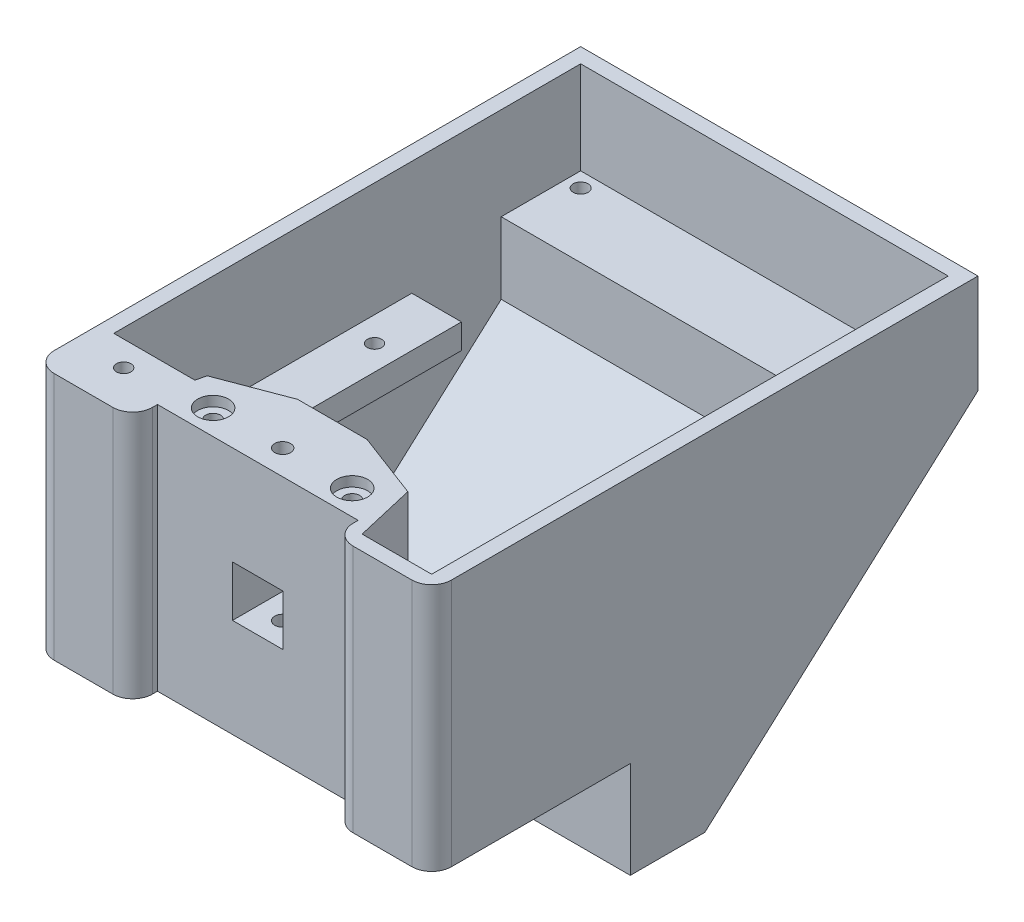
from build123d import *

# Parameters (mm, degrees)
BOSS_EXTRUDE1_DEPTH = 80
SHELL1_T            = -3
SKETCH3_W           = 46
SKETCH3_H           = 47
BOSS_EXTRUDE2_DEPTH = 17
SKETCH4_W           = 10.2
SKETCH4_H           = 10.2
CUT_EXTRUDE1_DEPTH  = 20
SKETCH6_W           = 15
SKETCH6_H           = 12.8
CUT_EXTRUDE2_DEPTH  = 3
SKETCH7_W           = 40.4
SKETCH7_H           = 50
CUT_EXTRUDE3_DEPTH  = 5
FILLET1_R           = 4
CUT_EXTRUDE7_DEPTH  = 47
SKETCH13_R          = 1.5
CUT_EXTRUDE8_DEPTH  = 25
SKETCH14_R          = 3.1
CUT_EXTRUDE9_DEPTH  = 2
SKETCH17_W          = 45
SKETCH17_H          = 5
BOSS_EXTRUDE5_DEPTH = 74
CUT_EXTRUDE10_REACH = 126.093
SKETCH18_W          = 54
SKETCH18_H          = 45
CUT_EXTRUDE11_REACH = 126.093
SKETCH19_R          = 1.45
BOSS_EXTRUDE6_DEPTH = 47
SKETCH22_R          = 1.45
CUT_EXTRUDE12_DEPTH = 135.415364765
BOSS_EXTRUDE7_DEPTH = 74
SKETCH27_R          = 1.5
CUT_EXTRUDE14_DEPTH = 10
CUT_EXTRUDE15_START = -3
CUT_EXTRUDE15_DEPTH = 32
CUT_EXTRUDE16_DEPTH = 30
BOSS_EXTRUDE8_DEPTH = 20
SKETCH31_R          = 1.5
CUT_EXTRUDE17_DEPTH = 123.649786567
CUT_EXTRUDE18_DEPTH = 15
CUT_EXTRUDE19_REACH = 126.093
SKETCH33_W          = 10
SKETCH33_H          = 5
SKETCH34_R          = 1.6
CUT_EXTRUDE20_DEPTH = 135.415364765
CUT_EXTRUDE22_DEPTH = 14


with BuildPart() as part:
    # Sketch2 → Boss-Extrude1 (new body)
    with BuildSketch(Plane(origin=(0, 0, 0), x_dir=(0, 0, -1), z_dir=(1, 0, 0))):
        Polygon((-27.320490368, 20.998248687), (-27.320490368, -29.001751313), (12.679509632, -29.001751313), (12.679509632, -48.511383538), (27.679509632, -48.511383538), (82.679509632, 0.998248687), (82.679509632, 20.998248687), align=None)
    extrude(amount=BOSS_EXTRUDE1_DEPTH)

    # Shell1
    shell1_openings = [part.faces().sort_by_distance(p)[0] for p in [
        (40, 20.998248687, -27.679509632),
    ]]
    offset(amount=SHELL1_T, openings=shell1_openings, kind=Kind.INTERSECTION)

    # Sketch3 → Boss-Extrude2 (add)
    with BuildSketch(Plane(origin=(0, 0, 24.320490368), x_dir=(-1, 0, 0), z_dir=(0, 0, -1))):
        with Locations((-40, -2.501751313)):
            Rectangle(SKETCH3_W, SKETCH3_H)
    extrude(amount=BOSS_EXTRUDE2_DEPTH)

    # Sketch4 → Cut-Extrude1 (cut)
    with BuildSketch(Plane.XY.offset(27.320490368)):
        with Locations((40, -4.001751313)):
            Rectangle(SKETCH4_W, SKETCH4_H)
    extrude(amount=-CUT_EXTRUDE1_DEPTH, mode=Mode.SUBTRACT)

    # Sketch6 → Cut-Extrude2 (cut)
    with BuildSketch(Plane.XZ.offset(29.001751313)):
        with Locations((40, 0.920490368)):
            Rectangle(SKETCH6_W, SKETCH6_H)
    extrude(amount=-CUT_EXTRUDE2_DEPTH, mode=Mode.SUBTRACT)

    # Sketch7 → Cut-Extrude3 (cut)
    with BuildSketch(Plane.XY.offset(27.320490368)):
        with Locations((40, -4.001751313)):
            Rectangle(SKETCH7_W, SKETCH7_H)
    extrude(amount=-CUT_EXTRUDE3_DEPTH, mode=Mode.SUBTRACT)

    # Fillet1
    fillet1_edges = [part.edges().sort_by_distance(p)[0] for p in [
        (80, -4.001751313, 27.320490368),
        (19.8, -4.001751313, 27.320490368),
        (0, -4.001751313, 27.320490368),
        (60.2, -4.001751313, 27.320490368),
    ]]
    fillet(fillet1_edges, radius=FILLET1_R)

    # Sketch12 → Cut-Extrude7 (cut)
    with BuildSketch(Plane(origin=(0, 20.998248687, 0), x_dir=(1, 0, 0), z_dir=(0, 1, 0))):
        Polygon((33, -7.320490368), (19.8, -12.320490368), (17, -24.320490368), (17, -7.320490368), align=None)
        Polygon((47, -7.320490368), (63, -7.320490368), (63, -24.320490368), (60.2, -12.320490368), align=None)
    extrude(amount=-CUT_EXTRUDE7_DEPTH, mode=Mode.SUBTRACT)

    # Sketch13 → Cut-Extrude8 (cut)
    with BuildSketch(Plane(origin=(0, 20.998248687, 0), x_dir=(1, 0, 0), z_dir=(0, 1, 0))):
        with Locations(Location((26, -17.320490368, 0), (0, 0, 270))):
            Circle(SKETCH13_R)
        with Locations(Location((54, -17.320490368, 0), (0, 0, 270))):
            Circle(SKETCH13_R)
    extrude(amount=-CUT_EXTRUDE8_DEPTH, mode=Mode.SUBTRACT)

    # Sketch14 → Cut-Extrude9 (cut)
    with BuildSketch(Plane(origin=(0, 20.998248687, 0), x_dir=(1, 0, 0), z_dir=(0, 1, 0))):
        with Locations(Location((26, -17.320490368, 0), (0, 0, 270))):
            Circle(SKETCH14_R)
        with Locations(Location((54, -17.320490368, 0), (0, 0, 270))):
            Circle(SKETCH14_R)
    extrude(amount=-CUT_EXTRUDE9_DEPTH, mode=Mode.SUBTRACT)

    # Sketch17 → Boss-Extrude5 (add)
    with BuildSketch(Plane.ZY.offset(-77)):
        with Locations((-23.179509632, -4.501751313)):
            Rectangle(SKETCH17_W, SKETCH17_H)
    extrude(amount=BOSS_EXTRUDE5_DEPTH)

    # Sketch18 → Cut-Extrude10 (cut, up to next)
    with BuildSketch(Plane(origin=(0, -2.001751313, 0), x_dir=(1, 0, 0), z_dir=(0, 1, 0)), mode=Mode.PRIVATE) as cut_extrude10_sk1:
        with Locations((40, 23.179509632)):
            Rectangle(SKETCH18_W, SKETCH18_H)
    cut_extrude10_tool1 = extrude(cut_extrude10_sk1.sketch, amount=-CUT_EXTRUDE10_REACH, mode=Mode.PRIVATE) & part.part
    add(cut_extrude10_tool1.solids().sort_by_distance((40, -2.001751, -23.17951))[0], mode=Mode.SUBTRACT)

    # Sketch19 → Cut-Extrude11 (cut, up to next)
    with BuildSketch(Plane(origin=(0, -2.001751313, 0), x_dir=(1, 0, 0), z_dir=(0, 1, 0)), mode=Mode.PRIVATE) as cut_extrude11_sk1:
        with Locations(Location((72, 37.179509632, 0), (0, 0, 270))):
            Circle(SKETCH19_R)
    cut_extrude11_tool1 = extrude(cut_extrude11_sk1.sketch, amount=-CUT_EXTRUDE11_REACH, mode=Mode.PRIVATE) & part.part
    # Sketch19 → Cut-Extrude11 (cut, up to next)
    with BuildSketch(Plane(origin=(0, -2.001751313, 0), x_dir=(1, 0, 0), z_dir=(0, 1, 0)), mode=Mode.PRIVATE) as cut_extrude11_sk2:
        with Locations(Location((72, 6.179509632, 0), (0, 0, 270))):
            Circle(SKETCH19_R)
    cut_extrude11_tool2 = extrude(cut_extrude11_sk2.sketch, amount=-CUT_EXTRUDE11_REACH, mode=Mode.PRIVATE) & part.part
    # Sketch19 → Cut-Extrude11 (cut, up to next)
    with BuildSketch(Plane(origin=(0, -2.001751313, 0), x_dir=(1, 0, 0), z_dir=(0, 1, 0)), mode=Mode.PRIVATE) as cut_extrude11_sk3:
        with Locations(Location((8, 33.179509632, 0), (0, 0, 270))):
            Circle(SKETCH19_R)
    cut_extrude11_tool3 = extrude(cut_extrude11_sk3.sketch, amount=-CUT_EXTRUDE11_REACH, mode=Mode.PRIVATE) & part.part
    # Sketch19 → Cut-Extrude11 (cut, up to next)
    with BuildSketch(Plane(origin=(0, -2.001751313, 0), x_dir=(1, 0, 0), z_dir=(0, 1, 0)), mode=Mode.PRIVATE) as cut_extrude11_sk4:
        with Locations(Location((8, 6.179509632, 0), (0, 0, 270))):
            Circle(SKETCH19_R)
    cut_extrude11_tool4 = extrude(cut_extrude11_sk4.sketch, amount=-CUT_EXTRUDE11_REACH, mode=Mode.PRIVATE) & part.part
    add(cut_extrude11_tool1.solids().sort_by_distance((72, -2.001751, -37.17951))[0], mode=Mode.SUBTRACT)
    add(cut_extrude11_tool2.solids().sort_by_distance((72, -2.001751, -6.17951))[0], mode=Mode.SUBTRACT)
    add(cut_extrude11_tool3.solids().sort_by_distance((8, -2.001751, -33.17951))[0], mode=Mode.SUBTRACT)
    add(cut_extrude11_tool4.solids().sort_by_distance((8, -2.001751, -6.17951))[0], mode=Mode.SUBTRACT)

    # Sketch21 → Boss-Extrude6 (add)
    with BuildSketch(Plane(origin=(0, -26.001751313, 0), x_dir=(1, 0, 0), z_dir=(0, 1, 0))):
        Polygon((3, -24.320490368), (3, -14.320490368), (19.333333333, -14.320490368), (17, -24.320490368), align=None)
    extrude(amount=BOSS_EXTRUDE6_DEPTH)

    # Sketch22 → Cut-Extrude12 (cut, through all)
    with BuildSketch(Plane(origin=(0, 20.998248687, 0), x_dir=(1, 0, 0), z_dir=(0, 1, 0))):
        with Locations(Location((10, -19.320490368, 0), (0, 0, 270))):
            Circle(SKETCH22_R)
    extrude(amount=-CUT_EXTRUDE12_DEPTH, mode=Mode.SUBTRACT)

    # Sketch26 → Boss-Extrude7 (add)
    with BuildSketch(Plane(origin=(3, 0, 0), x_dir=(0, 0, -1), z_dir=(1, 0, 0))):
        Polygon((79.679509632, 2.334161996), (63.679509632, 2.334161996), (63.679509632, -12.068640106), align=None)
    extrude(amount=BOSS_EXTRUDE7_DEPTH)

    # Sketch27 → Cut-Extrude14 (cut)
    with BuildSketch(Plane(origin=(0, 2.334161996, 0), x_dir=(1, 0, 0), z_dir=(0, 1, 0))):
        with Locations(Location((6, 76.679509632, 0), (0, 0, 270))):
            Circle(SKETCH27_R)
        with Locations(Location((74, 76.679509632, 0), (0, 0, 270))):
            Circle(SKETCH27_R)
    extrude(amount=-CUT_EXTRUDE14_DEPTH, mode=Mode.SUBTRACT)

    # Sketch28 → Cut-Extrude15 (cut)
    with BuildSketch(Plane(origin=(0, 2.334161996, 0), x_dir=(1, 0, 0), z_dir=(0, 1, 0)).offset(CUT_EXTRUDE15_START)):
        Polygon((74, 79.929509632), (71.185417438, 78.304509632), (71.185417438, 75.054509632), (74, 73.429509632), (76.814582562, 75.054509632), (76.814582562, 78.304509632), align=None)
        Polygon((6, 73.429509632), (8.814582562, 75.054509632), (8.814582562, 78.304509632), (6, 79.929509632), (3.185417438, 78.304509632), (3.185417438, 75.054509632), align=None)
    extrude(amount=-CUT_EXTRUDE15_DEPTH, mode=Mode.SUBTRACT)

    # Sketch29 → Cut-Extrude16 (cut)
    with BuildSketch(Plane.XZ.offset(29.001751313)):
        Polygon((7.185417438, 17.695490368), (10, 16.070490368), (12.814582562, 17.695490368), (12.814582562, 20.945490368), (10, 22.570490368), (7.185417438, 20.945490368), align=None)
    extrude(amount=-CUT_EXTRUDE16_DEPTH, mode=Mode.SUBTRACT)

    # Sketch30 → Boss-Extrude8 (add)
    with BuildSketch(Plane(origin=(0, -26.001751313, 0), x_dir=(1, 0, 0), z_dir=(0, 1, 0))):
        Polygon((77, -24.320490368), (63, -24.320490368), (60.2, -12.320490368), (77, -12.320490368), align=None)
    extrude(amount=BOSS_EXTRUDE8_DEPTH)

    # Sketch31 → Cut-Extrude17 (cut, through all)
    with BuildSketch(Plane(origin=(0, -6.001751313, 0), x_dir=(1, 0, 0), z_dir=(0, 1, 0))):
        with Locations(Location((72, -21.320490368, 0), (0, 0, 270))):
            Circle(SKETCH31_R)
    extrude(amount=-CUT_EXTRUDE17_DEPTH, mode=Mode.SUBTRACT)

    # Sketch32 → Cut-Extrude18 (cut)
    with BuildSketch(Plane.XZ.offset(29.001751313)):
        Polygon((72, 24.570490368), (69.185417438, 22.945490368), (69.185417438, 19.695490368), (72, 18.070490368), (74.814582562, 19.695490368), (74.814582562, 22.945490368), align=None)
    extrude(amount=-CUT_EXTRUDE18_DEPTH, mode=Mode.SUBTRACT)

    # Sketch33 → Cut-Extrude19 (cut, up to next)
    with BuildSketch(Plane(origin=(0, -2.001751313, 0), x_dir=(1, 0, 0), z_dir=(0, 1, 0)), mode=Mode.PRIVATE) as cut_extrude19_sk1:
        with Locations((72, 43.179509632)):
            Rectangle(SKETCH33_W, SKETCH33_H)
    cut_extrude19_tool1 = extrude(cut_extrude19_sk1.sketch, amount=-CUT_EXTRUDE19_REACH, mode=Mode.PRIVATE) & part.part
    add(cut_extrude19_tool1.solids().sort_by_distance((72, -2.001751, -43.17951))[0], mode=Mode.SUBTRACT)

    # Sketch34 → Cut-Extrude20 (cut, through all)
    with BuildSketch(Plane(origin=(0, 20.998248687, 0), x_dir=(1, 0, 0), z_dir=(0, 1, 0))):
        with Locations(Location((40, -17.320490368, 0), (0, 0, 270))):
            Circle(SKETCH34_R)
    extrude(amount=-CUT_EXTRUDE20_DEPTH, mode=Mode.SUBTRACT)

    # Sketch36 → Cut-Extrude22 (cut)
    with BuildSketch(Plane.XZ.offset(29.001751313)):
        Polygon((38.375, 20.13507293), (36.75, 17.320490368), (38.375, 14.505907805), (41.625, 14.505907805), (43.25, 17.320490368), (41.625, 20.13507293), align=None)
    extrude(amount=-CUT_EXTRUDE22_DEPTH, mode=Mode.SUBTRACT)


solid = part.part
